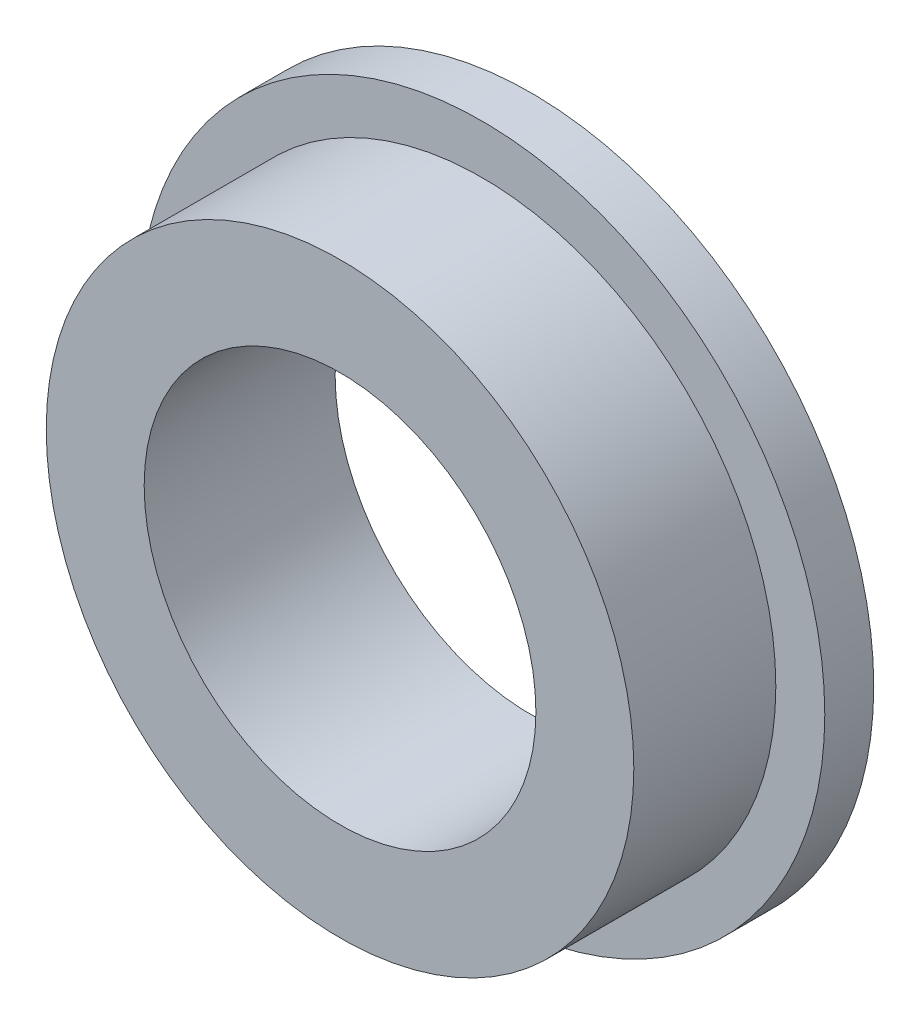
from build123d import *

# Parameters (mm, degrees)
SKETCH_2_R      = 7
SKETCH_2_R_2    = 4
EXTRUDE_1_DEPTH = 1
SKETCH_3_R      = 6
SKETCH_3_R_2    = 4
EXTRUDE_2_DEPTH = 2.9


with BuildPart() as part:
    # ｽｹｯﾁ2 → ﾎﾞｽ - 押し出し1 (new body)
    with BuildSketch(Plane.XY):
        Circle(SKETCH_2_R)
        Circle(SKETCH_2_R_2, mode=Mode.SUBTRACT)
    extrude(amount=EXTRUDE_1_DEPTH)

    # ｽｹｯﾁ3 → ﾎﾞｽ - 押し出し2 (add)
    with BuildSketch(Plane.XY.offset(1)):
        Circle(SKETCH_3_R)
        Circle(SKETCH_3_R_2, mode=Mode.SUBTRACT)
    extrude(amount=EXTRUDE_2_DEPTH)


solid = part.part
